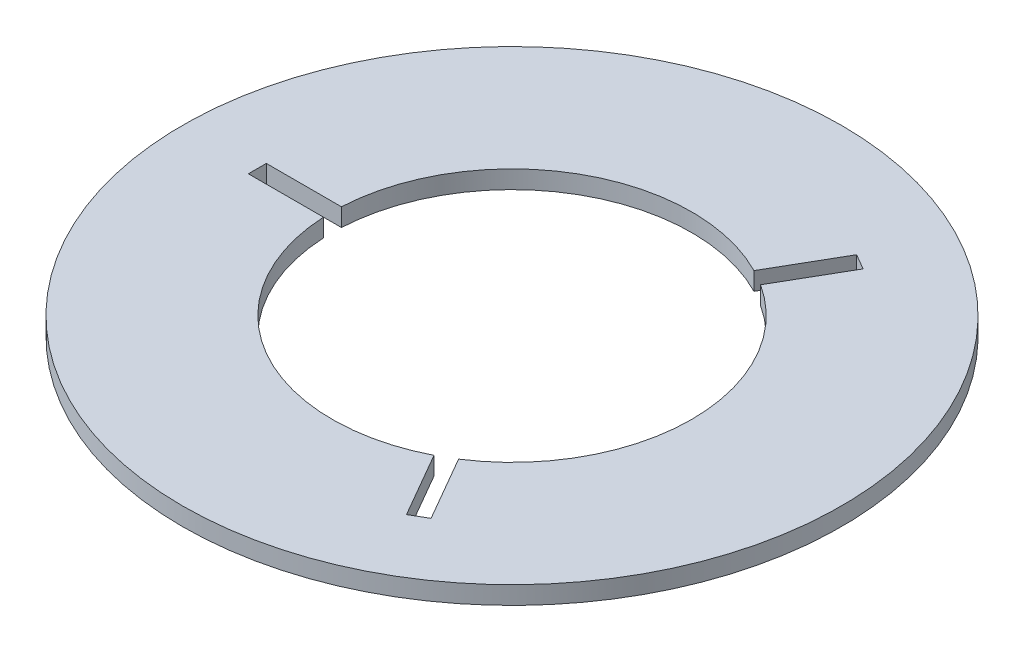
from build123d import *

# Parameters (mm, degrees)
SKETCH1_R           = 55
BOSS_EXTRUDE1_DEPTH = 3
SKETCH2_R           = 30
CUT_EXTRUDE1_DEPTH  = 3
SKETCH3_W           = 25
SKETCH3_H           = 3
CUT_EXTRUDE2_DEPTH  = 3
CIRPATTERN1_COUNT   = 3


with BuildPart() as part:
    # Sketch1 → Boss-Extrude1 (new body)
    with BuildSketch(Plane(origin=(0, 0, 0), x_dir=(1, 0, 0), z_dir=(0, 1, 0))):
        with Locations(Location((0, 0, 0), (0, 0, 270))):
            Circle(SKETCH1_R)
    extrude(amount=BOSS_EXTRUDE1_DEPTH)

    # Sketch2 → Cut-Extrude1 (cut)
    with BuildSketch(Plane(origin=(0, 3, 0), x_dir=(1, 0, 0), z_dir=(0, 1, 0))):
        with Locations(Location((0, 0, 0), (0, 0, 270))):
            Circle(SKETCH2_R)
    extrude(amount=-CUT_EXTRUDE1_DEPTH, mode=Mode.SUBTRACT)

    # Sketch3 → Cut-Extrude2 (cut)
    with BuildSketch(Plane(origin=(0, 3, 0), x_dir=(1, 0, 0), z_dir=(0, 1, 0))):
        with Locations((-30, 0)):
            Rectangle(SKETCH3_W, SKETCH3_H)
    cut_extrude2 = extrude(amount=-CUT_EXTRUDE2_DEPTH, mode=Mode.SUBTRACT)

    # CirPattern1: Cut-Extrude2 ×3 about axis
    cirpattern1_axis = Axis((0, 0, 0), (0, 1, 0))
    for i in range(1, CIRPATTERN1_COUNT):
        add(cut_extrude2.rotate(cirpattern1_axis, i * 360 / CIRPATTERN1_COUNT), mode=Mode.SUBTRACT)


solid = part.part
